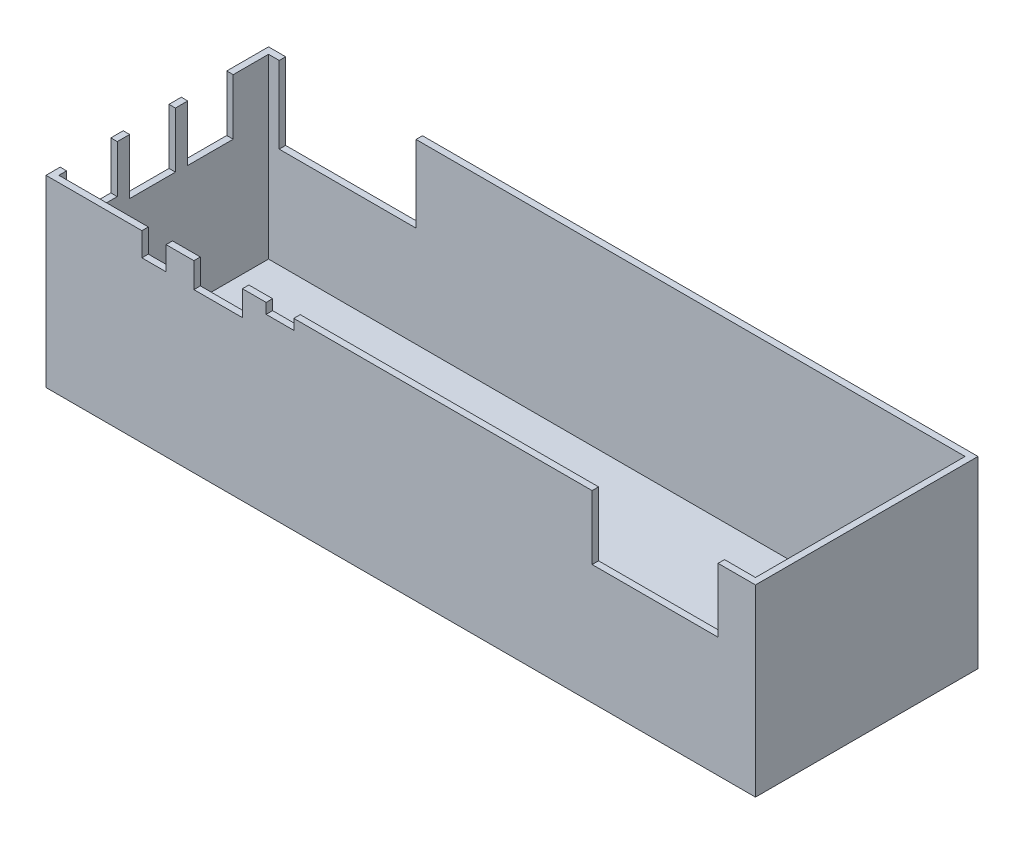
from build123d import *

# Parameters (mm, degrees)
ESQUISSE1_W            = 220
ESQUISSE1_H            = 57
BOSS_EXTRU_1_DEPTH     = 69
COQUE1_T               = -2
ESQUISSE2_W            = 42.430934458
ESQUISSE2_H            = 23.81944652
TROU_CABLES_DEPTH      = 10
ESQUISSE4_W            = 39.063130892
ESQUISSE4_H            = 19.851704837
TROU_BORNIER_DEPTH     = 10
ESQUISSE5_W            = 15.700605502
ESQUISSE5_H            = 14.772120087
TROU_RASPBERRY_1_DEPTH = 10
ESQUISSE6_W            = 14.187422576
ESQUISSE6_H            = 17.21673515
TROU_RASPBERRY_2_DEPTH = 10
ESQUISSE7_W            = 14.101040577
ESQUISSE7_H            = 17.33071114
TROU_RASPBERRY_3_DEPTH = 10
ESQUISSE8_W            = 7.498357612
ESQUISSE8_H            = 7.301962728
TROU_RASPBERRY_4_DEPTH = 10
ESQUISSE9_W            = 15.051909722
ESQUISSE9_H            = 7.770311475
TROU_RASPBERRY_5_DEPTH = 10
ESQUISSE10_W           = 8.572607217
ESQUISSE10_H           = 3.212302761
TROU_RASPBERRY_6_DEPTH = 10


with BuildPart() as part:
    # Esquisse1 → Boss.-Extru.1 (new body)
    with BuildSketch(Plane.XY):
        with Locations((37.797752809, 14.679775281)):
            Rectangle(ESQUISSE1_W, ESQUISSE1_H)
    extrude(amount=BOSS_EXTRU_1_DEPTH)

    # Coque1
    coque1_openings = [part.faces().sort_by_distance(p)[0] for p in [
        (37.797752809, 43.179775281, 34.5),
    ]]
    offset(amount=COQUE1_T, openings=coque1_openings, kind=Kind.INTERSECTION)

    # Esquisse2 → Trou cables (cut)
    with BuildSketch(Plane(origin=(0, 0, 0), x_dir=(-1, 0, 0), z_dir=(0, 0, -1))):
        with Locations((45.673767677, 31.270052021)):
            Rectangle(ESQUISSE2_W, ESQUISSE2_H)
    extrude(amount=-TROU_CABLES_DEPTH, mode=Mode.SUBTRACT)

    # Esquisse4 → trou bornier (cut)
    with BuildSketch(Plane.XY.offset(69)):
        with Locations((116.674495492, 33.253922863)):
            Rectangle(ESQUISSE4_W, ESQUISSE4_H)
    extrude(amount=-TROU_BORNIER_DEPTH, mode=Mode.SUBTRACT)

    # Esquisse5 → trou raspberry 1 (cut)
    with BuildSketch(Plane.ZY.offset(72.202247191)):
        with Locations((56.756295127, 35.793715238)):
            Rectangle(ESQUISSE5_W, ESQUISSE5_H)
    extrude(amount=-TROU_RASPBERRY_1_DEPTH, mode=Mode.SUBTRACT)

    # Esquisse6 → trou raspberry 2 (cut)
    with BuildSketch(Plane.ZY.offset(72.202247191)):
        with Locations((37.961253625, 34.571407706)):
            Rectangle(ESQUISSE6_W, ESQUISSE6_H)
    extrude(amount=-TROU_RASPBERRY_2_DEPTH, mode=Mode.SUBTRACT)

    # Esquisse7 → trou raspberry 3 (cut)
    with BuildSketch(Plane.ZY.offset(72.202247191)):
        with Locations((19.999072944, 34.514419711)):
            Rectangle(ESQUISSE7_W, ESQUISSE7_H)
    extrude(amount=-TROU_RASPBERRY_3_DEPTH, mode=Mode.SUBTRACT)

    # Esquisse8 → trou raspberry 4 (cut)
    with BuildSketch(Plane.XY.offset(69)):
        with Locations((-38.723319171, 39.528793917)):
            Rectangle(ESQUISSE8_W, ESQUISSE8_H)
    extrude(amount=-TROU_RASPBERRY_4_DEPTH, mode=Mode.SUBTRACT)

    # Esquisse9 → trou raspberry 5 (cut)
    with BuildSketch(Plane.XY.offset(69)):
        with Locations((-18.817046732, 39.294619544)):
            Rectangle(ESQUISSE9_W, ESQUISSE9_H)
    extrude(amount=-TROU_RASPBERRY_5_DEPTH, mode=Mode.SUBTRACT)

    # Esquisse10 → trou raspberry 6 (cut)
    with BuildSketch(Plane.XY.offset(69)):
        with Locations((0.345482943, 41.573623901)):
            Rectangle(ESQUISSE10_W, ESQUISSE10_H)
    extrude(amount=-TROU_RASPBERRY_6_DEPTH, mode=Mode.SUBTRACT)


solid = part.part
